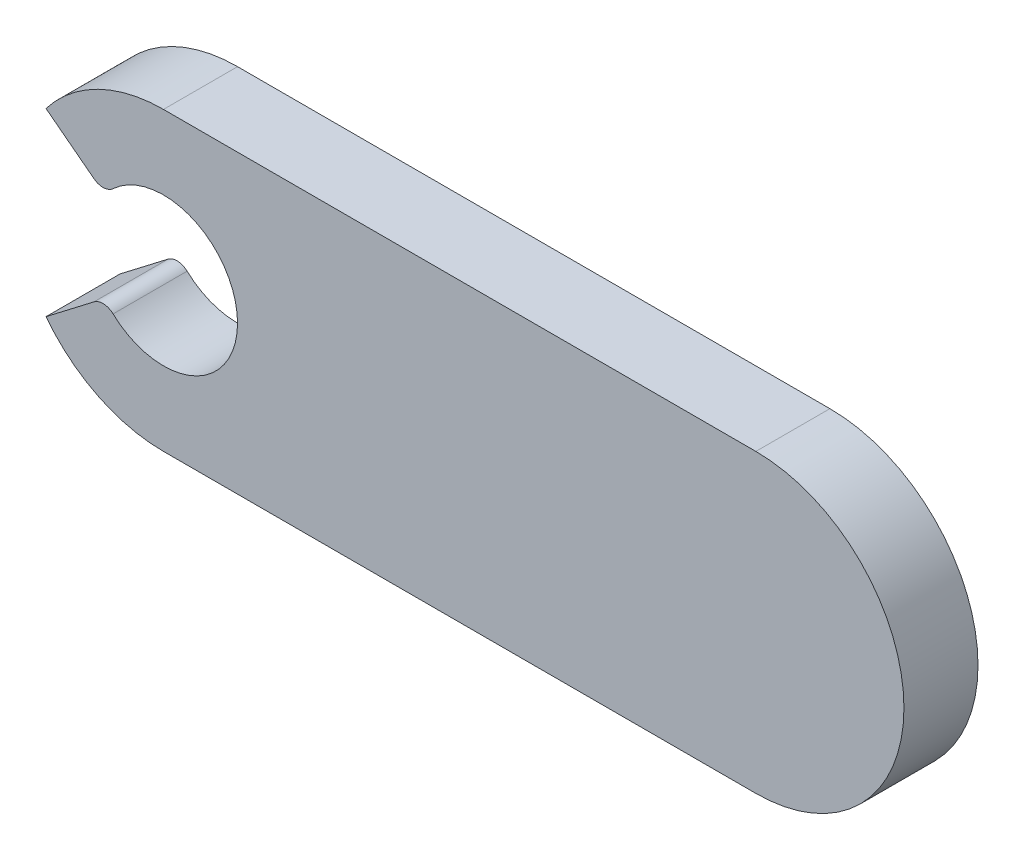
from build123d import *

# Parameters (mm, degrees)
BOSS_EXTRUDE1_DEPTH = 2.5
FILLET1_R           = 0.5


with BuildPart() as part:
    # Sketch1 → Boss-Extrude1 (new body)
    with BuildSketch(Plane.XY):
        with BuildLine():
            Line((-3.966766701, 3.043807145), (-1.983383351, 1.521903573))
            ThreePointArc((-1.983383351, 1.521903573), (2.5, 0), (-1.983383351, -1.521903573))
            Line((-1.983383351, -1.521903573), (-3.966766701, -3.043807145))
            ThreePointArc((-3.966766701, -3.043807145), (-2.211443451, -4.484363708), (0, -5))
            Line((0, -5), (20, -5))
            ThreePointArc((20, -5), (25, 0), (20, 5))
            Line((20, 5), (0, 5))
            ThreePointArc((0, 5), (-2.211443451, 4.484363708), (-3.966766701, 3.043807145))
        make_face()
    extrude(amount=BOSS_EXTRUDE1_DEPTH)

    # Fillet1
    fillet1_edges = [part.edges().sort_by_distance(p)[0] for p in [
        (-1.983383351, -1.521903573, 1.25),
        (-1.983383351, 1.521903573, 1.25),
    ]]
    fillet(fillet1_edges, radius=FILLET1_R)


solid = part.part
